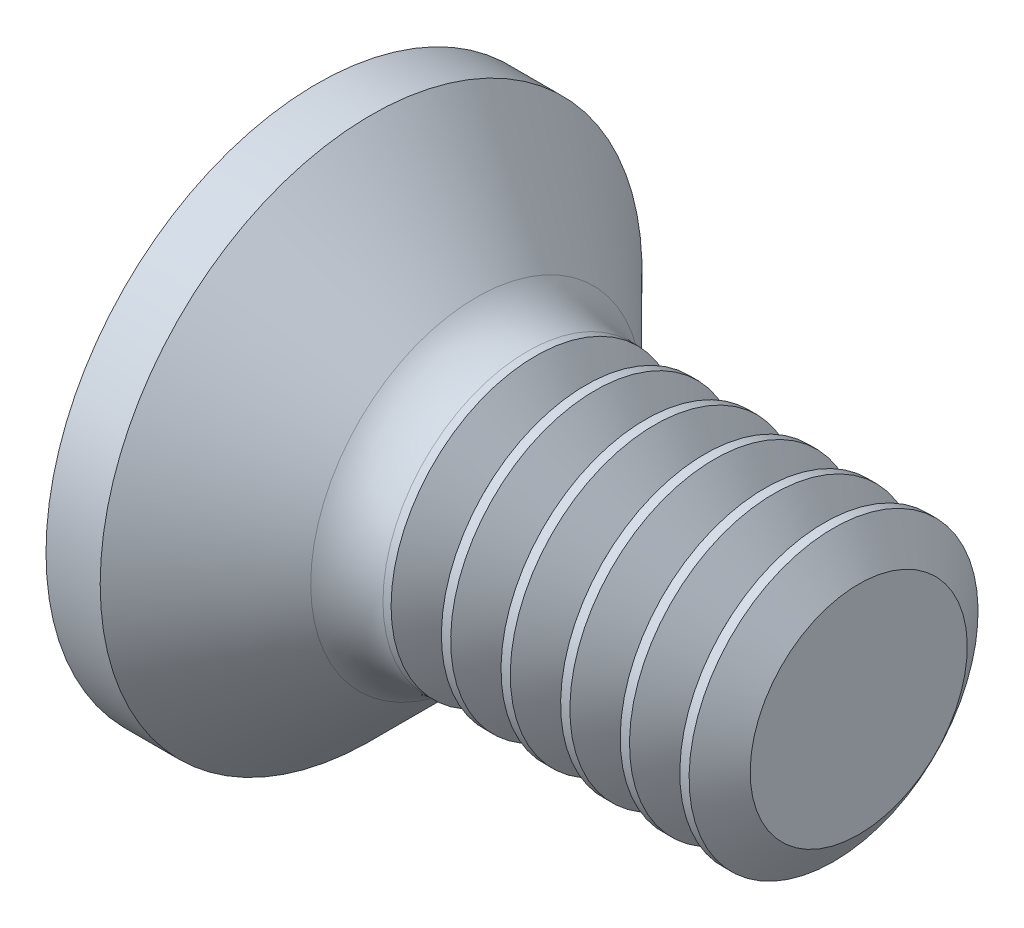
from build123d import *

# Parameters (mm, degrees)
FILLET1_R       = 0.4
RECPAT_COUNT    = 2
RECPAT_ANGLE    = 90
THDSCHPAT_COUNT = 6
THDSCHPAT_PITCH = 0.33


with BuildPart() as part:
    # BodySke → Base-Revolve (revolve)
    with BuildSketch(Plane.XY, mode=Mode.PRIVATE) as base_revolve_sk:
        Polygon((0, 0), (0, 1.5), (0.3, 1.5), (1, 0.8), (3, 0.8), (3, 0), align=None)
    revolve(base_revolve_sk.sketch.rotate(Axis((-6.35, 0, 0), (1, 0, 0)), 90), axis=Axis((-6.35, 0, 0), (1, 0, 0)))

    # Fillet1
    fillet1_edges = [part.edges().sort_by_distance(p)[0] for p in [
        (1, 0, -0.8),
    ]]
    fillet(fillet1_edges, radius=FILLET1_R)

    # Sketch3 → Recess section 0
    with BuildSketch(Plane.ZY):
        with BuildLine():
            Line((-0.24, 0.8), (0.24, 0.8))
            Line((0.24, 0.8), (0.24, -0.8))
            Line((0.24, -0.8), (-0.24, -0.8))
            Line((-0.24, -0.8), (-0.24, 0.8))
        make_face()
    # Sketch4 → Recess section 1
    with BuildSketch(Plane.ZY.offset(-0.95)):
        with BuildLine():
            Line((-0.24, 0.326347552), (0.24, 0.326347552))
            Line((0.24, 0.326347552), (0.24, -0.326347552))
            Line((0.24, -0.326347552), (-0.24, -0.326347552))
            Line((-0.24, -0.326347552), (-0.24, 0.326347552))
        make_face()
    recess = loft(mode=Mode.SUBTRACT)

    # RecPat: Recess ×2 about axis
    recpat_axis = Axis((0, 0, 0), (1, 0, 0))
    for i in range(1, RECPAT_COUNT):
        add(recess.rotate(recpat_axis, i * RECPAT_ANGLE / (RECPAT_COUNT - 1)), mode=Mode.SUBTRACT)

    # RecCorSke → RecessCore (revolve, cut)
    with BuildSketch(Plane.XY, mode=Mode.PRIVATE) as recesscore_sk:
        Polygon((0, 0), (0, 0.421930471), (0.95, 0.3555), (1.065508952, 0), align=None)
    revolve(recesscore_sk.sketch.rotate(Axis((-3.175, 0, 0), (1, 0, 0)), 90), axis=Axis((-3.175, 0, 0), (1, 0, 0)), mode=Mode.SUBTRACT)

    # ThdSchSke → ThreadSchematic (revolve, cut)
    with BuildSketch(Plane.XY, mode=Mode.PRIVATE) as threadschematic_sk:
        Polygon((1.350001, -0.601), (1.2106597, -0.8), (1.2106597, -1), (1.4893423, -1), (1.4893423, -0.8), align=None)
    threadschematic = revolve(threadschematic_sk.sketch.rotate(Axis((-3.175, 0, 0), (1, 0, 0)), 270), axis=Axis((-3.175, 0, 0), (1, 0, 0)), mode=Mode.SUBTRACT)

    # ThdSchPat: ThreadSchematic ×6
    with Locations(*[(i * THDSCHPAT_PITCH, 0, 0) for i in range(1, THDSCHPAT_COUNT)]):
        add(threadschematic, mode=Mode.SUBTRACT)


solid = part.part
